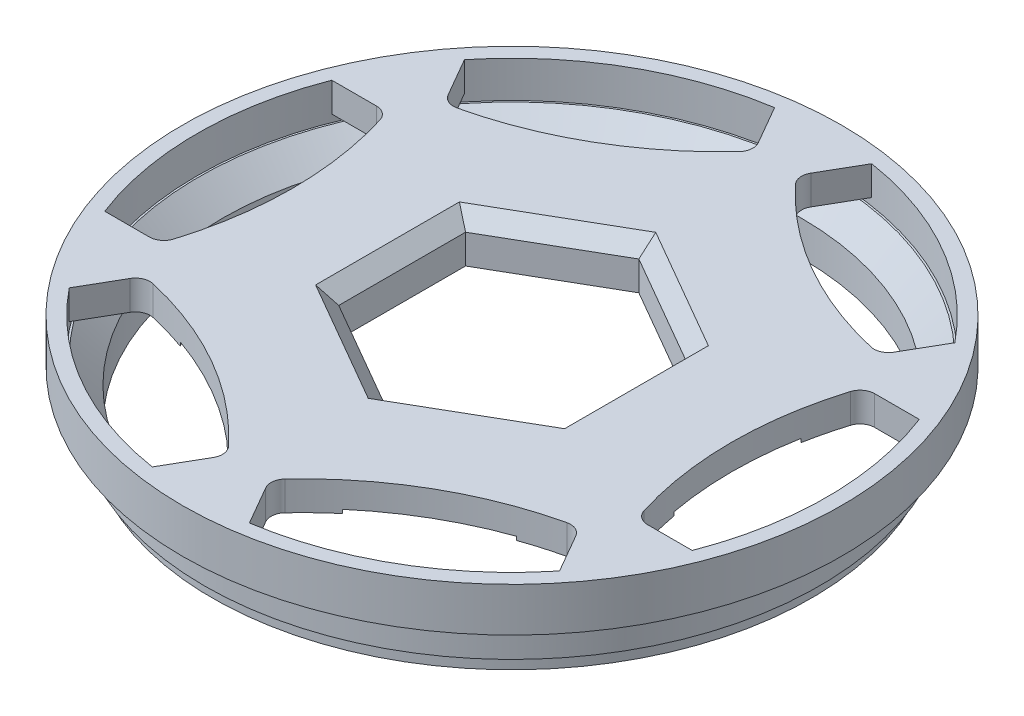
from build123d import *

# Parameters (mm, degrees)
SKIZZE1_R                             = 44
AUFSATZ_LINEAR_AUSTRAGEN1_DEPTH       = 4
SCHNITT_LINEAR_START                  = -10
SCHNITT_LINEAR_AUSTRAGEN2_DEPTH       = 10
KREISMUSTER1_COUNT                    = 6
SCHNITT_LINEAR_AUSTRAGEN3_DEPTH       = 4
SCHNITT_LINEAR_AUSTRAGEN3_DEPTH_BACK  = 10
VERRUNDUNG1_R                         = 2
SKIZZE7_R                             = 32
SCHNITT_LINEAR_AUSTRAGEN7_DEPTH       = 0.5
SKIZZE8_R                             = 45
SKIZZE8_R_2                           = 43
AUFSATZ_LINEAR_AUSTRAGEN2_DEPTH       = 5
SKIZZE9_R                             = 45
SKIZZE9_R_2                           = 39.5
AUFSATZ_LINEAR_AUSTRAGEN3_DEPTH       = 8
SKIZZE4_R                             = 21.007106764
AUFSATZ_LINEAR_AUSTRAGEN8_DEPTH       = 6
FASE1_SIZE                            = 3.25
SKIZZE10_R                            = 50
SKIZZE10_R_2                          = 42
SCHNITT_LINEAR_AUSTRAGEN9_DEPTH       = 7
SKIZZE11_R                            = 50
SKIZZE11_R_2                          = 40.9
SCHNITT_LINEAR_AUSTRAGEN10_DEPTH      = 2
SCHNITT_LINEAR_AUSTRAGEN11_DEPTH      = 6
SCHNITT_LINEAR_AUSTRAGEN11_DEPTH_BACK = 6
FASE3_SIZE                            = 2
FASE5_SIZE                            = 2


with BuildPart() as part:
    # Skizze1 → Aufsatz-Linear austragen1 (new body)
    with BuildSketch(Plane(origin=(0, 0, 0), x_dir=(1, 0, 0), z_dir=(0, 1, 0))):
        Circle(SKIZZE1_R)
    extrude(amount=AUFSATZ_LINEAR_AUSTRAGEN1_DEPTH)

    # Skizze2 → Schnitt-Linear austragen2 (cut)
    with BuildSketch(Plane(origin=(0, 4, 0), x_dir=(1, 0, 0), z_dir=(0, 1, 0)).offset(SCHNITT_LINEAR_START)):
        with BuildLine():
            ThreePointArc((-30, 0), (-30.647234858, 7.855929826), (-32.571484726, 15.5))
            Line((-32.571484726, 15.5), (-41.179485184, 15.5))
            ThreePointArc((-41.179485184, 15.5), (-44, 0), (-41.179485184, -15.5))
            Line((-41.179485184, -15.5), (-32.571484726, -15.5))
            ThreePointArc((-32.571484726, -15.5), (-30.647234858, -7.855929826), (-30, 0))
        make_face()
    schnitt_linear_austragen2 = extrude(amount=SCHNITT_LINEAR_AUSTRAGEN2_DEPTH, mode=Mode.SUBTRACT)

    # Kreismuster1: Schnitt-Linear austragen2 ×6 about axis
    kreismuster1_axis = Axis((0, 0, 0), (0, 1, 0))
    for i in range(1, KREISMUSTER1_COUNT):
        add(schnitt_linear_austragen2.rotate(kreismuster1_axis, i * 360 / KREISMUSTER1_COUNT), mode=Mode.SUBTRACT)

    # Skizze3 → Schnitt-Linear austragen3 (cut, two sides: drawn at the far end of the back side and taken through both)
    with BuildSketch(Plane.XZ.offset(-SCHNITT_LINEAR_AUSTRAGEN3_DEPTH_BACK)):
        Polygon((15, 8.660254038), (0, 17.320508076), (-15, 8.660254038), (-15, -8.660254038), (0, -17.320508076), (15, -8.660254038), align=None)
    extrude(amount=SCHNITT_LINEAR_AUSTRAGEN3_DEPTH + SCHNITT_LINEAR_AUSTRAGEN3_DEPTH_BACK, mode=Mode.SUBTRACT)

    # Verrundung1
    verrundung1_edges = [part.edges().sort_by_distance(p)[0] for p in [
        (-32.571484726, 2, 15.5),
        (-2.862348604, 2, 35.957733212),
        (2.862348604, 2, 35.957733212),
        (29.709136122, 2, 20.457733212),
        (32.571484726, 2, 15.5),
        (32.571484726, 2, -15.5),
        (29.709136122, 2, -20.457733212),
        (2.862348604, 2, -35.957733212),
        (-2.862348604, 2, -35.957733212),
        (-29.709136122, 2, -20.457733212),
        (-32.571484726, 2, -15.5),
        (-29.709136122, 2, 20.457733212),
    ]]
    fillet(verrundung1_edges, radius=VERRUNDUNG1_R)

    # Skizze7 → Schnitt-Linear austragen7 (cut)
    with BuildSketch(Plane.XZ):
        Circle(SKIZZE7_R)
    extrude(amount=-SCHNITT_LINEAR_AUSTRAGEN7_DEPTH, mode=Mode.SUBTRACT)

    # Skizze8 → Aufsatz-Linear austragen2 (add)
    with BuildSketch(Plane(origin=(0, 4, 0), x_dir=(1, 0, 0), z_dir=(0, 1, 0))):
        Circle(SKIZZE8_R)
        Circle(SKIZZE8_R_2, mode=Mode.SUBTRACT)
    extrude(amount=-AUFSATZ_LINEAR_AUSTRAGEN2_DEPTH)



with BuildPart() as body_2:
    # Skizze9 → Aufsatz-Linear austragen3 (new body)
    with BuildSketch(Plane.XZ.offset(1)):
        Circle(SKIZZE9_R)
        Circle(SKIZZE9_R_2, mode=Mode.SUBTRACT)
    extrude(amount=AUFSATZ_LINEAR_AUSTRAGEN3_DEPTH)


with BuildPart() as part_1:
    add(part.part)

    add(body_2.part)  # Aufsatz-Linear austragen8 merges body 2
    # Skizze4 → Aufsatz-Linear austragen8 (add)
    with BuildSketch(Plane(origin=(0, 4, 0), x_dir=(1, 0, 0), z_dir=(0, 1, 0))):
        Circle(SKIZZE4_R)
    extrude(amount=-AUFSATZ_LINEAR_AUSTRAGEN8_DEPTH)

    # Fase1
    fase1_edges = [part_1.edges().sort_by_distance(p)[0] for p in [
        (-39.5, -1, 0),
    ]]
    chamfer(fase1_edges, length=FASE1_SIZE)

    # Skizze10 → Schnitt-Linear austragen9 (cut)
    with BuildSketch(Plane.XZ.offset(9)):
        Circle(SKIZZE10_R)
        Circle(SKIZZE10_R_2, mode=Mode.SUBTRACT)
    extrude(amount=-SCHNITT_LINEAR_AUSTRAGEN9_DEPTH, mode=Mode.SUBTRACT)

    # Skizze11 → Schnitt-Linear austragen10 (cut)
    with BuildSketch(Plane.XZ.offset(9)):
        with Locations((-1.948563864, 1.772578218)):
            Circle(SKIZZE11_R)
        Circle(SKIZZE11_R_2, mode=Mode.SUBTRACT)
    extrude(amount=-SCHNITT_LINEAR_AUSTRAGEN10_DEPTH, mode=Mode.SUBTRACT)

    # Skizze3<3> → Schnitt-Linear austragen11 (cut, two sides: drawn at the far end of the back side and taken through both)
    with BuildSketch(Plane.XZ.offset(-SCHNITT_LINEAR_AUSTRAGEN11_DEPTH_BACK)):
        Polygon((15, 8.660254038), (0, 17.320508076), (-15, 8.660254038), (-15, -8.660254038), (0, -17.320508076), (15, -8.660254038), align=None)
    extrude(amount=SCHNITT_LINEAR_AUSTRAGEN11_DEPTH + SCHNITT_LINEAR_AUSTRAGEN11_DEPTH_BACK, mode=Mode.SUBTRACT)

    # Fase3
    fase3_edges = [part_1.edges().sort_by_distance(p)[0] for p in [
        (-21.007106764, -2, 0),
    ]]
    chamfer(fase3_edges, length=FASE3_SIZE)

    # Fase5
    fase5_edges = [part_1.edges().sort_by_distance(p)[0] for p in [
        (-7.5, 4, 12.990381057),
        (7.5, 4, 12.990381057),
        (15, 4, 0),
        (7.5, 4, -12.990381057),
        (-7.5, 4, -12.990381057),
        (-15, 4, 0),
    ]]
    chamfer(fase5_edges, length=FASE5_SIZE)


solid = part_1.part
